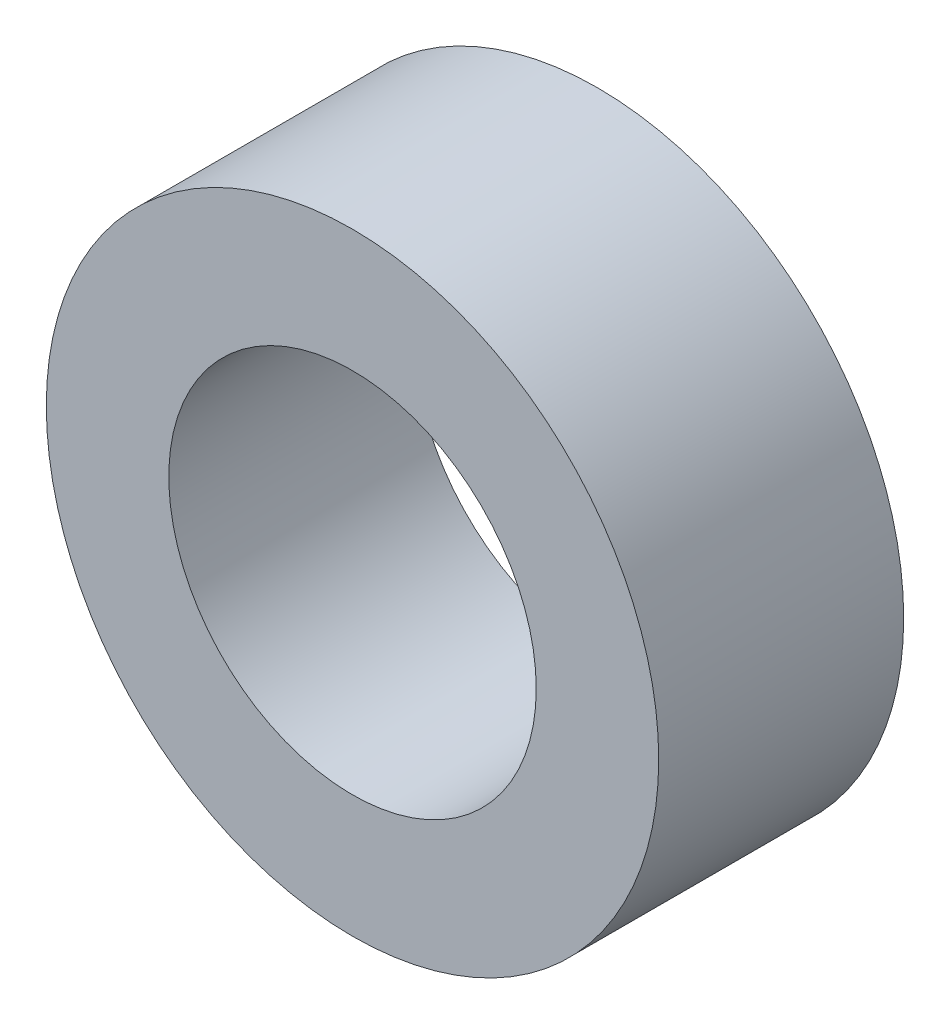
from build123d import *

# Parameters (mm, degrees)
SKETCH1_R           = 15.875
SKETCH1_R_2         = 9.525
BOSS_EXTRUDE1_DEPTH = 12.7


with BuildPart() as part:
    # Sketch1 → Boss-Extrude1 (new body)
    with BuildSketch(Plane.XY):
        Circle(SKETCH1_R)
        Circle(SKETCH1_R_2, mode=Mode.SUBTRACT)
    extrude(amount=BOSS_EXTRUDE1_DEPTH)


solid = part.part
